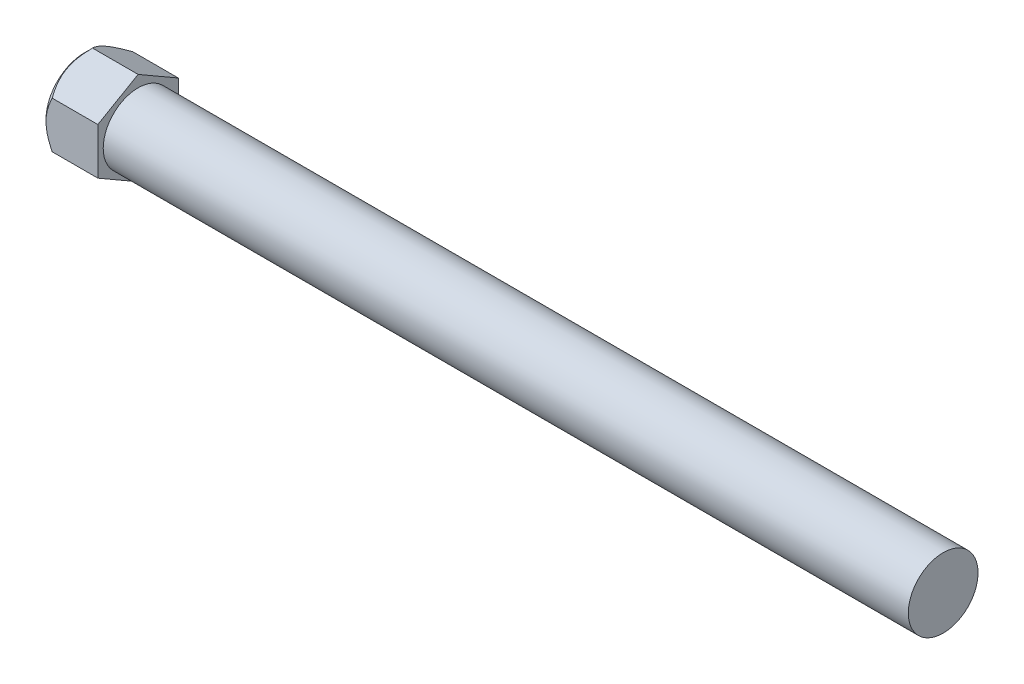
from build123d import *

# Parameters (mm, degrees)
BOSS_EXTRUDE1_DEPTH = 5.08
SKETCH3_R           = 3.302
BOSS_EXTRUDE2_DEPTH = 76.2


with BuildPart() as part:
    # Sketch2 → Boss-Extrude1 (new body)
    with BuildSketch(Plane(origin=(0, 0, 0), x_dir=(0, 0, -1), z_dir=(1, 0, 0))):
        Polygon((0, -4.399409051), (3.81, -2.199704526), (3.81, 2.199704526), (0, 4.399409051), (-3.81, 2.199704526), (-3.81, -2.199704526), align=None)
    extrude(amount=BOSS_EXTRUDE1_DEPTH)

    # Sketch3 → Boss-Extrude2 (add)
    with BuildSketch(Plane(origin=(5.08, 0, 0), x_dir=(0, 0, -1), z_dir=(1, 0, 0))):
        with Locations(Location((0, 0, 0), (0, 0, 180))):
            Circle(SKETCH3_R)
    extrude(amount=BOSS_EXTRUDE2_DEPTH)

    # Sketch4 → Cut-Revolve1 (revolve, cut)
    with BuildSketch(Plane.XY, mode=Mode.PRIVATE) as cut_revolve1_sk:
        Polygon((5.08, 4.399409051), (0.762, 4.399409051), (0, 3.637409051), (0, 2.199704526), (-1.146784512, 2.199704526), (-1.146784512, 5.580945805), (5.08, 5.580945805), align=None)
    revolve(cut_revolve1_sk.sketch.rotate(Axis((0, 0, 0), (1, 0, 0)), 300.000000093), axis=Axis((0, 0, 0), (1, 0, 0)), mode=Mode.SUBTRACT)


solid = part.part
